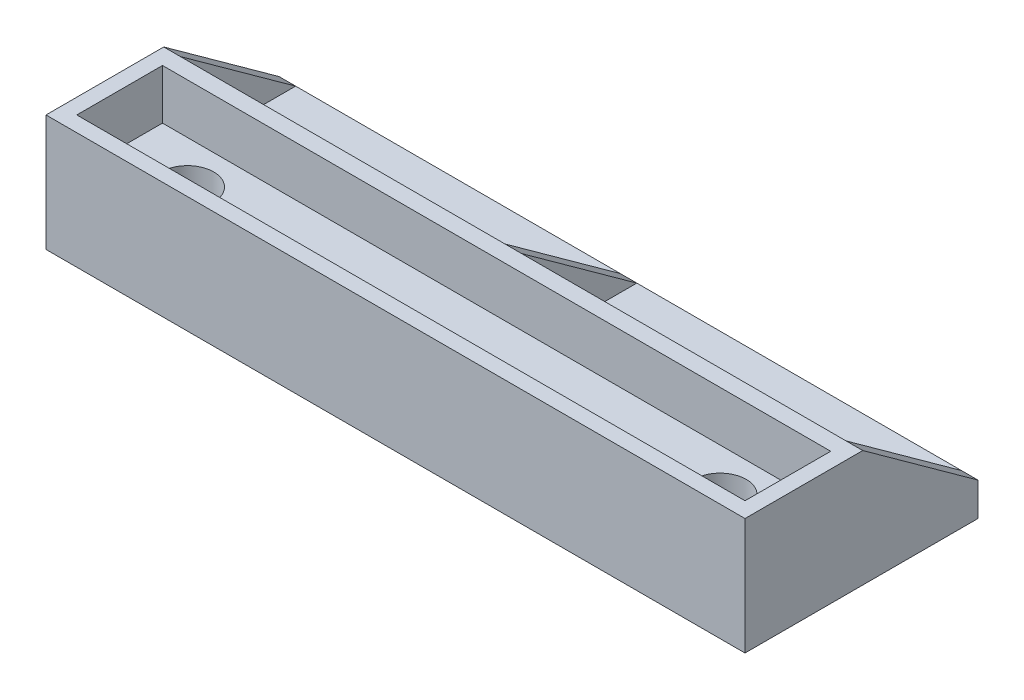
from build123d import *

# Parameters (mm, degrees)
SKETCH1_W               = 42
SKETCH1_H               = 7
RISER_DEPTH             = 7
SKETCH2_R               = 1.575
MOUNTING_HOLES_DEPTH    = 44.150898021
SKETCH3_W               = 40.15
SKETCH3_H               = 5.15
RECESS_DEPTH            = 3
SKETCH4_W               = 42
SKETCH4_H               = 7
FLANGE_DEPTH            = 7
SKETCH5_W               = 19.5
SKETCH5_H               = 6.925
FLANGE_CUTOUT_DEPTH     = 5
ANGLE_CUTOUT_DEPTH      = 27.594172294
ANGLE_CUTOUT_DEPTH_BACK = 27.594172294
FLANGE_CHAMFER_1_SIZE   = 1
FLANGE_CHAMFER_2_SIZE   = 1


with BuildPart() as part:
    # Sketch1 → Riser (new body)
    with BuildSketch(Plane(origin=(0, 0, 0), x_dir=(1, 0, 0), z_dir=(0, 1, 0))):
        with Locations((21, 3.5)):
            Rectangle(SKETCH1_W, SKETCH1_H)
    extrude(amount=RISER_DEPTH)

    # Sketch2 → Mounting Holes (cut, through all)
    with BuildSketch(Plane.XZ):
        with Locations(Location((5, -3.5, 0), (0, 0, 90))):
            Circle(SKETCH2_R)
        with Locations(Location((37, -3.5, 0), (0, 0, 270))):
            Circle(SKETCH2_R)
    extrude(amount=-MOUNTING_HOLES_DEPTH, mode=Mode.SUBTRACT)

    # Sketch3 → Recess (cut)
    with BuildSketch(Plane(origin=(0, 7, 0), x_dir=(1, 0, 0), z_dir=(0, 1, 0))):
        with Locations((21, 3.5)):
            Rectangle(SKETCH3_W, SKETCH3_H)
    extrude(amount=-RECESS_DEPTH, mode=Mode.SUBTRACT)

    # Sketch4 → Flange (add)
    with BuildSketch(Plane(origin=(0, 0, 0), x_dir=(1, 0, 0), z_dir=(0, 1, 0))):
        with Locations((21, 10.5)):
            Rectangle(SKETCH4_W, SKETCH4_H)
    extrude(amount=FLANGE_DEPTH)

    # Sketch5 → Flange Cutout (cut)
    with BuildSketch(Plane(origin=(0, 7, 0), x_dir=(1, 0, 0), z_dir=(0, 1, 0))):
        with Locations((10.75, 10.5375)):
            Rectangle(SKETCH5_W, SKETCH5_H)
        with Locations((31.25, 10.5375)):
            Rectangle(SKETCH5_W, SKETCH5_H)
    extrude(amount=-FLANGE_CUTOUT_DEPTH, mode=Mode.SUBTRACT)

    # Sketch7 → Angle Cutout (cut, two sides: drawn at the far end of the back side and taken through both)
    with BuildSketch(Plane.ZY.offset(-20.5).offset(-ANGLE_CUTOUT_DEPTH_BACK)):
        Polygon((-7.075, 7), (-14, 2), (-14, 7), align=None)
    extrude(amount=ANGLE_CUTOUT_DEPTH + ANGLE_CUTOUT_DEPTH_BACK, mode=Mode.SUBTRACT)

    # Flange Chamfer 1
    flange_chamfer_1_edges = [part.edges().sort_by_distance(p)[0] for p in [
        (10.75, 2, -7.075),
    ]]
    chamfer(flange_chamfer_1_edges, length=FLANGE_CHAMFER_1_SIZE)

    # Flange Chamfer 2
    flange_chamfer_2_edges = [part.edges().sort_by_distance(p)[0] for p in [
        (31.25, 2, -7.075),
    ]]
    chamfer(flange_chamfer_2_edges, length=FLANGE_CHAMFER_2_SIZE)


solid = part.part
